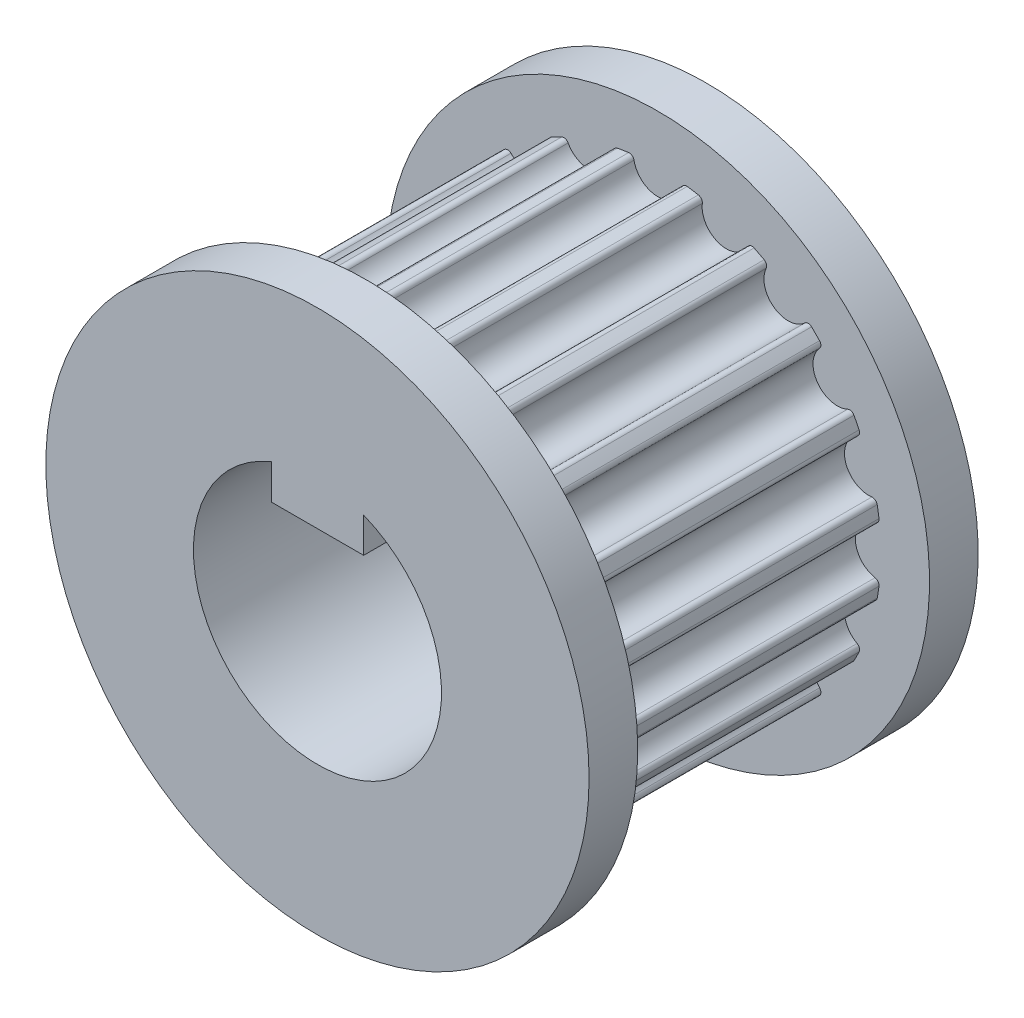
from build123d import *

# Parameters (mm, degrees)
BOSS_EXTRUDE1_DEPTH = 12
SKETCH2_R           = 5.1
CUT_EXTRUDE1_DEPTH  = 18.611866566
FILLET1_R           = 0.2
BOSS_EXTRUDE2_START = 2
SKETCH4_R           = 11.17
SKETCH4_R_2         = 5.1
BOSS_EXTRUDE2_DEPTH = 2
SKETCH6_R           = 11.17
SKETCH6_R_2         = 5.1
BOSS_EXTRUDE3_DEPTH = 2
SKETCH8_W           = 3.8
SKETCH8_H           = 3.6
BOSS_EXTRUDE4_DEPTH = 16


with BuildPart() as part:
    # Sketch1 → Boss-Extrude1 (new body)
    with BuildSketch(Plane.XY):
        with BuildLine():
            ThreePointArc((9.1153125, -0.999989014), (8.12, 0), (9.1153125, 0.999989014))
            ThreePointArc((9.1153125, 0.999989014), (9.057102083, 1.434504044), (8.978190951, 1.865740404))
            ThreePointArc((8.978190951, 1.865740404), (7.722578912, 2.509217994), (8.360163752, 3.767832539))
            ThreePointArc((8.360163752, 3.767832539), (8.170529827, 4.163092883), (7.962221516, 4.548838151))
            ThreePointArc((7.962221516, 4.548838151), (6.569217994, 4.772816249), (6.786663927, 6.166854364))
            ThreePointArc((6.786663927, 6.166854364), (6.484169183, 6.484169183), (6.166854364, 6.786663927))
            ThreePointArc((6.166854364, 6.786663927), (4.772816249, 6.569217994), (4.548838151, 7.962221516))
            ThreePointArc((4.548838151, 7.962221516), (4.163092883, 8.170529827), (3.767832539, 8.360163752))
            ThreePointArc((3.767832539, 8.360163752), (2.509217994, 7.722578912), (1.865740404, 8.978190951))
            ThreePointArc((1.865740404, 8.978190951), (1.434504044, 9.057102083), (0.999989014, 9.1153125))
            ThreePointArc((0.999989014, 9.1153125), (0, 8.12), (-0.999989014, 9.1153125))
            ThreePointArc((-0.999989014, 9.1153125), (-1.434504044, 9.057102083), (-1.865740404, 8.978190951))
            ThreePointArc((-1.865740404, 8.978190951), (-2.509217994, 7.722578912), (-3.767832539, 8.360163752))
            ThreePointArc((-3.767832539, 8.360163752), (-4.163092883, 8.170529827), (-4.548838151, 7.962221516))
            ThreePointArc((-4.548838151, 7.962221516), (-4.772816249, 6.569217994), (-6.166854364, 6.786663927))
            ThreePointArc((-6.166854364, 6.786663927), (-6.484169183, 6.484169183), (-6.786663927, 6.166854364))
            ThreePointArc((-6.786663927, 6.166854364), (-6.569217994, 4.772816249), (-7.962221516, 4.548838151))
            ThreePointArc((-7.962221516, 4.548838151), (-8.170529827, 4.163092883), (-8.360163752, 3.767832539))
            ThreePointArc((-8.360163752, 3.767832539), (-7.722578912, 2.509217994), (-8.978190951, 1.865740404))
            ThreePointArc((-8.978190951, 1.865740404), (-9.057102083, 1.434504044), (-9.1153125, 0.999989014))
            ThreePointArc((-9.1153125, 0.999989014), (-8.12, 0), (-9.1153125, -0.999989014))
            ThreePointArc((-9.1153125, -0.999989014), (-9.057102083, -1.434504044), (-8.978190951, -1.865740404))
            ThreePointArc((-8.978190951, -1.865740404), (-7.722578912, -2.509217994), (-8.360163752, -3.767832539))
            ThreePointArc((-8.360163752, -3.767832539), (-8.170529827, -4.163092883), (-7.962221516, -4.548838151))
            ThreePointArc((-7.962221516, -4.548838151), (-6.569217994, -4.772816249), (-6.786663927, -6.166854364))
            ThreePointArc((-6.786663927, -6.166854364), (-6.484169183, -6.484169183), (-6.166854364, -6.786663927))
            ThreePointArc((-6.166854364, -6.786663927), (-4.772816249, -6.569217994), (-4.548838151, -7.962221516))
            ThreePointArc((-4.548838151, -7.962221516), (-4.163092883, -8.170529827), (-3.767832539, -8.360163752))
            ThreePointArc((-3.767832539, -8.360163752), (-2.509217994, -7.722578912), (-1.865740404, -8.978190951))
            ThreePointArc((-1.865740404, -8.978190951), (-1.434504044, -9.057102083), (-0.999989014, -9.1153125))
            ThreePointArc((-0.999989014, -9.1153125), (0, -8.12), (0.999989014, -9.1153125))
            ThreePointArc((0.999989014, -9.1153125), (1.434504044, -9.057102083), (1.865740404, -8.978190951))
            ThreePointArc((1.865740404, -8.978190951), (2.509217994, -7.722578912), (3.767832539, -8.360163752))
            ThreePointArc((3.767832539, -8.360163752), (4.163092883, -8.170529827), (4.548838151, -7.962221516))
            ThreePointArc((4.548838151, -7.962221516), (4.772816249, -6.569217994), (6.166854364, -6.786663927))
            ThreePointArc((6.166854364, -6.786663927), (6.484169183, -6.484169183), (6.786663927, -6.166854364))
            ThreePointArc((6.786663927, -6.166854364), (6.569217994, -4.772816249), (7.962221516, -4.548838151))
            ThreePointArc((7.962221516, -4.548838151), (8.170529827, -4.163092883), (8.360163752, -3.767832539))
            ThreePointArc((8.360163752, -3.767832539), (7.722578912, -2.509217994), (8.978190951, -1.865740404))
            ThreePointArc((8.978190951, -1.865740404), (9.057102083, -1.434504044), (9.1153125, -0.999989014))
        make_face()
    extrude(amount=BOSS_EXTRUDE1_DEPTH)

    # Sketch2 → Cut-Extrude1 (cut, through all)
    with BuildSketch(Plane.XY.offset(12)):
        Circle(SKETCH2_R)
    extrude(amount=-CUT_EXTRUDE1_DEPTH, mode=Mode.SUBTRACT)

    # Fillet1
    fillet1_edges = [part.edges().sort_by_distance(p)[0] for p in [
        (-1.865740404, 8.978190951, 6),
        (-0.999989014, 9.1153125, 6),
        (0.999989014, 9.1153125, 6),
        (1.865740404, 8.978190951, 6),
        (3.767832539, 8.360163752, 6),
        (4.548838151, 7.962221516, 6),
        (6.166854364, 6.786663927, 6),
        (6.786663927, 6.166854364, 6),
        (7.962221516, 4.548838151, 6),
        (8.360163752, 3.767832539, 6),
        (8.978190951, 1.865740404, 6),
        (9.1153125, 0.999989014, 6),
        (9.1153125, -0.999989014, 6),
        (8.978190951, -1.865740404, 6),
        (8.360163752, -3.767832539, 6),
        (7.962221516, -4.548838151, 6),
        (6.786663927, -6.166854364, 6),
        (6.166854364, -6.786663927, 6),
        (4.548838151, -7.962221516, 6),
        (3.767832539, -8.360163752, 6),
        (1.865740404, -8.978190951, 6),
        (0.999989014, -9.1153125, 6),
        (-0.999989014, -9.1153125, 6),
        (-1.865740404, -8.978190951, 6),
        (-3.767832539, -8.360163752, 6),
        (-4.548838151, -7.962221516, 6),
        (-6.166854364, -6.786663927, 6),
        (-6.786663927, -6.166854364, 6),
        (-7.962221516, -4.548838151, 6),
        (-8.360163752, -3.767832539, 6),
        (-8.978190951, -1.865740404, 6),
        (-9.1153125, -0.999989014, 6),
        (-9.1153125, 0.999989014, 6),
        (-8.978190951, 1.865740404, 6),
        (-8.360163752, 3.767832539, 6),
        (-7.962221516, 4.548838151, 6),
        (-6.786663927, 6.166854364, 6),
        (-6.166854364, 6.786663927, 6),
        (-4.548838151, 7.962221516, 6),
        (-3.767832539, 8.360163752, 6),
    ]]
    fillet(fillet1_edges, radius=FILLET1_R)

    # Sketch4 → Boss-Extrude2 (add)
    with BuildSketch(Plane.XY.offset(12).offset(BOSS_EXTRUDE2_START)):
        Circle(SKETCH4_R)
        Circle(SKETCH4_R_2, mode=Mode.SUBTRACT)
    extrude(amount=-BOSS_EXTRUDE2_DEPTH)

    # Sketch6 → Boss-Extrude3 (add)
    with BuildSketch(Plane(origin=(0, 0, 0), x_dir=(-1, 0, 0), z_dir=(0, 0, -1))):
        with Locations(Location((0, 0, 0), (0, 0, 180))):
            Circle(SKETCH6_R)
        with Locations(Location((0, 0, 0), (0, 0, 180))):
            Circle(SKETCH6_R_2, mode=Mode.SUBTRACT)
    extrude(amount=BOSS_EXTRUDE3_DEPTH)

    # Sketch8 → Boss-Extrude4 (add)
    with BuildSketch(Plane.XY.offset(14)):
        with Locations((0, 5.1)):
            Rectangle(SKETCH8_W, SKETCH8_H)
    extrude(amount=-BOSS_EXTRUDE4_DEPTH)


solid = part.part
